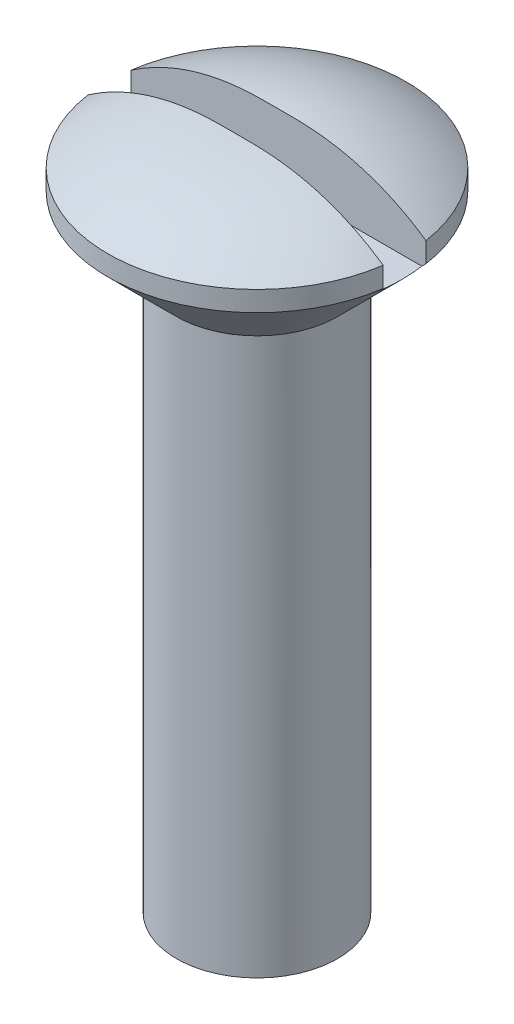
from build123d import *

# Parameters (mm, degrees)
CUT_EXTRUDE_1_DEPTH = 1.6


with BuildPart() as part:
    # Эскиз1 → Revolve 322 (revolve)
    with BuildSketch(Plane.XY, mode=Mode.PRIVATE) as revolve_322_sk:
        with BuildLine():
            Line((0, 0), (2, 0))
            Line((2, 0), (2, 13.8))
            Line((2, 13.8), (3.7, 15.5))
            Line((3.7, 15.5), (3.7, 16))
            ThreePointArc((3.7, 16), (2.191994284, 16.74407188), (0.53, 17))
            Line((0.53, 17), (0, 17))
            Line((0, 17), (0, 0))
        make_face()
    revolve(revolve_322_sk.sketch.rotate(Axis((0, 0, 0), (0, 1, 0)), 90), axis=Axis((0, 0, 0), (0, 1, 0)))

    # Эскиз2 → Вырез-Вытянуть1 (cut)
    with BuildSketch(Plane(origin=(0, 17, 0), x_dir=(-1, 0, 0), z_dir=(0, 1, 0))):
        with BuildLine():
            Line((-3.661843798, -0.53), (3.661843798, -0.53))
            ThreePointArc((3.661843798, -0.53), (3.7, 0), (3.661843798, 0.53))
            Line((3.661843798, 0.53), (-3.661843798, 0.53))
            ThreePointArc((-3.661843798, 0.53), (-3.7, 0), (-3.661843798, -0.53))
        make_face()
    extrude(amount=-CUT_EXTRUDE_1_DEPTH, mode=Mode.SUBTRACT)


solid = part.part
